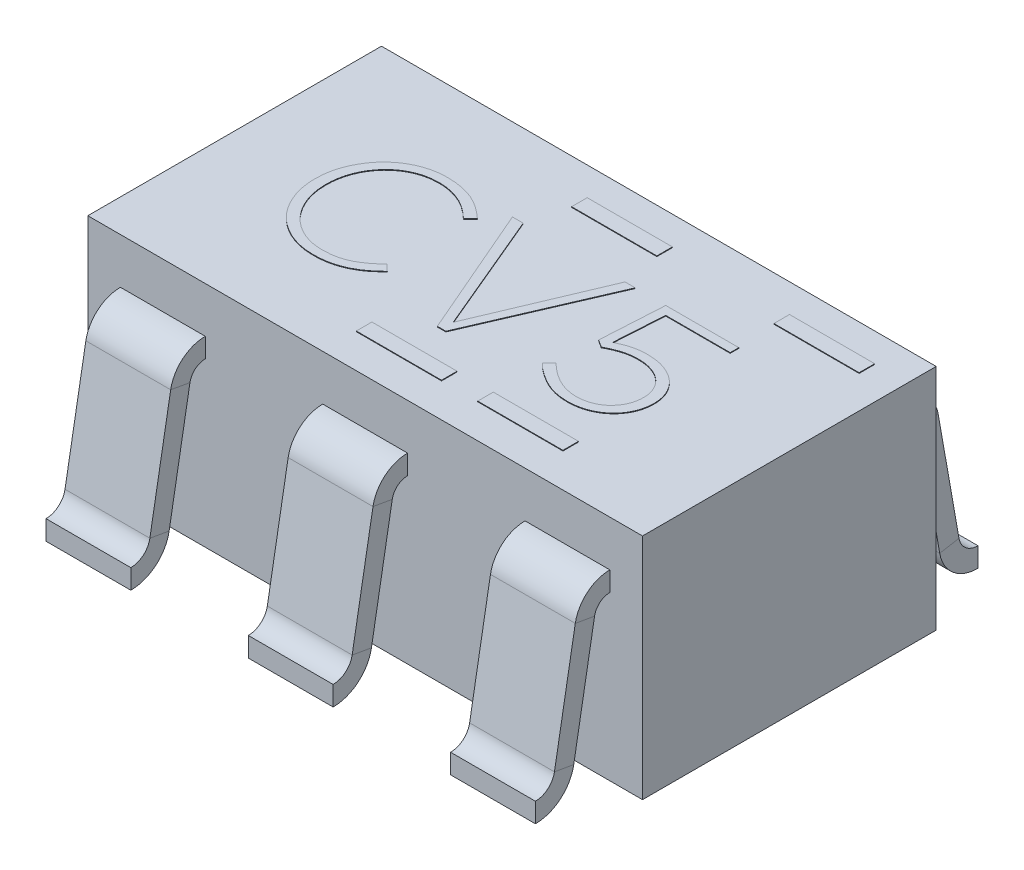
from build123d import *

# Parameters (mm, degrees)
SKETCH1_W           = 2.159
SKETCH1_H           = 1.143
BOSS_EXTRUDE1_DEPTH = 0.889
SKETCH2_W           = 0.3302
SKETCH2_H           = 0.0762
SKETCH4_W           = 0.3302
SKETCH4_H           = 0.0762
SKETCH5_W           = 0.331663062
SKETCH5_H           = 0.06055278
BOSS_EXTRUDE2_DEPTH = 0.00254


with BuildPart() as part:
    # Sketch1 → Boss-Extrude1 (new body)
    with BuildSketch(Plane(origin=(0, 0, 0), x_dir=(1, 0, 0), z_dir=(0, 1, 0))):
        Rectangle(SKETCH1_W, SKETCH1_H)
    extrude(amount=BOSS_EXTRUDE1_DEPTH)

    # Sweep1: sweep along a path in Sketch3
    with BuildLine(Plane(origin=(0, 0, 0), x_dir=(0, 0, -1), z_dir=(1, 0, 0))) as sweep1_path:
        ThreePointArc((-0.861267633, 0), (-0.763979988, 0.035409807), (-0.712214314, 0.125070585))
        Line((-0.712214314, 0.125070585), (-0.631121327, 0.584971766))
        ThreePointArc((-0.631121327, 0.584971766), (-0.610415058, 0.620836077), (-0.5715, 0.635))
    # Sketch2 → Sweep1 (sweep)
    with BuildSketch(Plane.XY.offset(0.5715)):
        with Locations((-0.7874, 0.6731)):
            Rectangle(SKETCH2_W, SKETCH2_H)
        with Locations((0.7874, 0.6731)):
            Rectangle(SKETCH2_W, SKETCH2_H)
    sweep1 = sweep(path=sweep1_path.line)

    # Mirror1: Sweep1 across plane
    add(sweep1.mirror(Plane.XY))

    # Sweep2: sweep along a path in Sketch3<2>
    with BuildLine(Plane(origin=(0, 0, 0), x_dir=(0, 0, -1), z_dir=(1, 0, 0))) as sweep2_path:
        ThreePointArc((-0.861267633, 0), (-0.763979988, 0.035409807), (-0.712214314, 0.125070585))
        Line((-0.712214314, 0.125070585), (-0.631121327, 0.584971766))
        ThreePointArc((-0.631121327, 0.584971766), (-0.610415058, 0.620836077), (-0.5715, 0.635))
    # Sketch4 → Sweep2 (sweep)
    with BuildSketch(Plane.XY.offset(0.5715)):
        with Locations((0, 0.6731)):
            Rectangle(SKETCH4_W, SKETCH4_H)
    sweep(path=sweep2_path.line)

    # Sketch5 → Boss-Extrude2 (add)
    with BuildSketch(Plane(origin=(0, 0.889, 0), x_dir=(1, 0, 0), z_dir=(0, 1, 0))):
        with Locations((0, 0.428222097)):
            Rectangle(SKETCH5_W, SKETCH5_H)
        with Locations((0, -0.409764759)):
            Rectangle(SKETCH5_W, SKETCH5_H)
        with Locations((0.472520764, -0.409764759)):
            Rectangle(SKETCH5_W, SKETCH5_H)
        with Locations((0.7874, 0.428222097)):
            Rectangle(SKETCH5_W, SKETCH5_H)
        with BuildLine():
            add(Edge.make_bspline(
                [(-0.507148397, -0.266530468), (-0.516004062, -0.266294122), (-0.533483711, -0.265827613), (-0.559226467, -0.261984327), (-0.583951487, -0.25558492), (-0.607575838, -0.246825997), (-0.629831551, -0.235789415), (-0.650715741, -0.222985246), (-0.669897071, -0.208097721), (-0.687638562, -0.191631506), (-0.70351359, -0.173255806), (-0.717682508, -0.153325217), (-0.730032672, -0.131802707), (-0.740548666, -0.108883725), (-0.749060866, -0.084753269), (-0.755090531, -0.059664466), (-0.758731432, -0.033734206), (-0.759226432, -0.016197616), (-0.759477344, -0.007308428)],
                knots=[0, 0, 0, 0, 1.054195513, 2.080811273, 3.09136329, 4.090928071, 5.075437235, 6.045312843, 7.0030623, 7.962201522, 8.923166792, 9.889447214, 10.870064349, 11.873653196, 12.888490594, 13.912113605, 14.941663336, 16, 16, 16, 16], degree=3))
            Line((-0.759477344, -0.007308428), (-0.759477344, -0.005846257))
            add(Edge.make_bspline(
                [(-0.759477344, -0.005846257), (-0.759233862, 0.002939366), (-0.758752483, 0.020309046), (-0.75498612, 0.045997417), (-0.748805696, 0.070927441), (-0.740273046, 0.095037208), (-0.729424891, 0.117928225), (-0.717111271, 0.139648693), (-0.702714075, 0.159670138), (-0.686895619, 0.178373653), (-0.669203848, 0.195244904), (-0.650021202, 0.210455446), (-0.62910642, 0.223465742), (-0.606852552, 0.23470478), (-0.583216962, 0.243725639), (-0.558358696, 0.250182657), (-0.532378411, 0.254174408), (-0.514682579, 0.254614311), (-0.505686226, 0.254837953)],
                knots=[0, 0, 0, 0, 1.041832373, 2.059762397, 3.072350947, 4.084602614, 5.087749651, 6.073758899, 7.042027807, 8.008630923, 8.975383991, 9.937007889, 10.907467045, 11.891814537, 12.890386669, 13.902031662, 14.933417564, 16, 16, 16, 16], degree=3))
            add(Edge.make_bspline(
                [(-0.505686226, 0.254837953), (-0.500148127, 0.254802759), (-0.48937231, 0.254734278), (-0.473627058, 0.253481406), (-0.45869352, 0.251795116), (-0.44451559, 0.249237701), (-0.430985983, 0.246114503), (-0.417988527, 0.242327636), (-0.405480578, 0.237997005), (-0.38958505, 0.231239197), (-0.370577221, 0.221539205), (-0.349199721, 0.207512116), (-0.328706848, 0.19189923), (-0.315841334, 0.180357552), (-0.309337542, 0.174522986)],
                knots=[0, 0, 0, 0, 0.914254497, 1.778920911, 2.606817561, 3.395102384, 4.156514643, 4.898826745, 5.629742143, 6.340854795, 7.749865447, 9.146767208, 10.55762974, 12, 12, 12, 12], degree=3))
            Line((-0.309337542, 0.174522986), (-0.336074384, 0.1471595))
            add(Edge.make_bspline(
                [(-0.336074384, 0.1471595), (-0.341648926, 0.152352202), (-0.352771327, 0.162712751), (-0.370557647, 0.176855412), (-0.389109711, 0.189876206), (-0.40931986, 0.200539535), (-0.430986673, 0.209385531), (-0.450249932, 0.214997837), (-0.466520306, 0.218351942), (-0.479401357, 0.220055233), (-0.492746026, 0.221301889), (-0.501818861, 0.221378216), (-0.506417312, 0.221416901)],
                knots=[0, 0, 0, 0, 1.196272513, 2.386819074, 3.566920493, 4.751031721, 5.967618357, 7.237862974, 7.896368677, 8.575399611, 9.277959423, 10, 10, 10, 10], degree=3))
            add(Edge.make_bspline(
                [(-0.506417312, 0.221416901), (-0.513879875, 0.221231437), (-0.528598993, 0.22086563), (-0.550266689, 0.217499069), (-0.571122473, 0.212127237), (-0.59099454, 0.204421397), (-0.609799831, 0.194915239), (-0.62743277, 0.183727735), (-0.64370962, 0.170774705), (-0.65865625, 0.156260563), (-0.672114795, 0.140215442), (-0.684218216, 0.122924296), (-0.694683588, 0.104230211), (-0.703501728, 0.084331902), (-0.710712304, 0.063402073), (-0.71562768, 0.041507132), (-0.718777182, 0.018823511), (-0.719171911, 0.003424741), (-0.719372081, -0.004384086)],
                knots=[0, 0, 0, 0, 1.034860358, 2.041152744, 3.034703784, 4.017914397, 4.992208653, 5.954356592, 6.910190429, 7.873513869, 8.840222493, 9.811746631, 10.797978486, 11.807847073, 12.828266177, 13.864129433, 14.916884699, 16, 16, 16, 16], degree=3))
            Line((-0.719372081, -0.004384086), (-0.719372081, -0.005846257))
            add(Edge.make_bspline(
                [(-0.719372081, -0.005846257), (-0.719180299, -0.013656152), (-0.718801148, -0.029096243), (-0.715512394, -0.05184426), (-0.7105084, -0.073892468), (-0.703101485, -0.094959649), (-0.694050513, -0.11496879), (-0.683445081, -0.133763561), (-0.671454414, -0.151260362), (-0.657920013, -0.167324934), (-0.642950053, -0.181839036), (-0.626708783, -0.194899587), (-0.609071935, -0.206186623), (-0.590268594, -0.215801752), (-0.570395391, -0.223600027), (-0.549551587, -0.229121435), (-0.52786311, -0.232419424), (-0.513147734, -0.232877265), (-0.505686226, -0.233109415)],
                knots=[0, 0, 0, 0, 1.079242995, 2.133653515, 3.171588202, 4.200589649, 5.215182267, 6.204443786, 7.180407667, 8.143660157, 9.103539566, 10.058955548, 11.020257913, 11.99325002, 12.97468206, 13.965908815, 14.968603549, 16, 16, 16, 16], degree=3))
            add(Edge.make_bspline(
                [(-0.505686226, -0.233109415), (-0.501193655, -0.233050529), (-0.492337728, -0.232934451), (-0.479299095, -0.231979648), (-0.466680499, -0.230407487), (-0.454539161, -0.228249807), (-0.442807999, -0.225423122), (-0.431602868, -0.221852655), (-0.420770462, -0.21779277), (-0.406847719, -0.211444443), (-0.389949814, -0.201744453), (-0.370035182, -0.188260028), (-0.350450367, -0.172411054), (-0.3380448, -0.160545641), (-0.331687871, -0.1544655)],
                knots=[0, 0, 0, 0, 0.822135291, 1.620624348, 2.391144691, 3.148513217, 3.876362449, 4.597769171, 5.299493563, 5.99236891, 7.395933389, 8.859155827, 10.390551289, 12, 12, 12, 12], degree=3))
            Line((-0.331687871, -0.1544655), (-0.306517641, -0.179009086))
            add(Edge.make_bspline(
                [(-0.306517641, -0.179009086), (-0.313282789, -0.185270427), (-0.326676453, -0.197666649), (-0.347602199, -0.21496314), (-0.369789737, -0.230078111), (-0.389445295, -0.240603131), (-0.405842335, -0.247916696), (-0.418734117, -0.252530715), (-0.4320494, -0.256783897), (-0.445926101, -0.260314289), (-0.460353862, -0.263155529), (-0.475387195, -0.265134736), (-0.491046721, -0.266271942), (-0.501715623, -0.26644324), (-0.507148397, -0.266530468)],
                knots=[0, 0, 0, 0, 1.473488271, 2.917216759, 4.335764993, 5.757540972, 6.475182698, 7.204086771, 7.945106539, 8.709093146, 9.491664519, 10.294494744, 11.131529659, 12, 12, 12, 12], degree=3))
        make_face()
        Polygon((-0.246464187, 0.248153743), (-0.20458343, 0.248153743), (-0.006772575, -0.222038691), (0.191769366, 0.248153743), (0.231456866, 0.248153743), (0.009102425, -0.266530468), (-0.024109746, -0.266530468), align=None)
        with BuildLine():
            add(Edge.make_bspline(
                [(0.480234827, -0.266530468), (0.47168649, -0.266255318), (0.454753779, -0.265710295), (0.429737761, -0.261154006), (0.40552872, -0.253718045), (0.38230305, -0.243405597), (0.36035076, -0.230974224), (0.339739056, -0.217200515), (0.320665209, -0.202136982), (0.309143011, -0.191012963), (0.30341657, -0.185484415)],
                knots=[0, 0, 0, 0, 1.027091986, 2.034483686, 3.045944865, 4.065436139, 5.082966719, 6.075467794, 7.043522885, 8, 8, 8, 8], degree=3))
            Line((0.30341657, -0.185484415), (0.330153412, -0.158747573))
            add(Edge.make_bspline(
                [(0.330153412, -0.158747573), (0.335914703, -0.164311572), (0.347236392, -0.175245557), (0.365416009, -0.189683487), (0.383813761, -0.202577462), (0.402684641, -0.213447845), (0.421925221, -0.222276477), (0.44161431, -0.228420326), (0.46155471, -0.232390043), (0.474994583, -0.232870041), (0.481696998, -0.233109415)],
                knots=[0, 0, 0, 0, 1.109179193, 2.17968211, 3.212685538, 4.219648281, 5.193340946, 6.139214123, 7.072032972, 8, 8, 8, 8], degree=3))
            add(Edge.make_bspline(
                [(0.481696998, -0.233109415), (0.486645725, -0.232983964), (0.496366705, -0.232737534), (0.510602808, -0.230951237), (0.524153616, -0.227951292), (0.53692357, -0.223614516), (0.548925915, -0.218321864), (0.560065946, -0.212042657), (0.570265792, -0.204772817), (0.579586176, -0.196629938), (0.587941612, -0.187574231), (0.595487102, -0.177901375), (0.602020727, -0.167434153), (0.60756542, -0.156294698), (0.611909994, -0.144479638), (0.615210595, -0.13222824), (0.617111695, -0.119502719), (0.61734968, -0.110885003), (0.617470024, -0.106527178)],
                knots=[0, 0, 0, 0, 1.145346535, 2.249849336, 3.315357495, 4.352544201, 5.366331399, 6.347897687, 7.307179358, 8.260859585, 9.207397063, 10.155202969, 11.096546173, 12.058801949, 13.030293121, 14.005687019, 14.991511462, 16, 16, 16, 16], degree=3))
            Line((0.617470024, -0.106527178), (0.617470024, -0.105169448))
            add(Edge.make_bspline(
                [(0.617470024, -0.105169448), (0.617350897, -0.1009158), (0.617116322, -0.092539822), (0.615219895, -0.08022716), (0.611928494, -0.068488808), (0.607550186, -0.057275579), (0.602017365, -0.046670663), (0.595264118, -0.036867277), (0.58765048, -0.027689531), (0.578883835, -0.019444068), (0.569260829, -0.011889483), (0.558674796, -0.005175804), (0.547098103, 0.000558154), (0.534720973, 0.005415121), (0.521649079, 0.009440776), (0.507903501, 0.012224606), (0.493577624, 0.013940297), (0.483825529, 0.014116809), (0.478877096, 0.014206375)],
                knots=[0, 0, 0, 0, 0.997445971, 1.964098809, 2.913068328, 3.851722655, 4.783138491, 5.711758029, 6.63915603, 7.574857543, 8.528837996, 9.505237224, 10.509512245, 11.554302971, 12.621166842, 13.713386878, 14.839721157, 16, 16, 16, 16], degree=3))
            add(Edge.make_bspline(
                [(0.478877096, 0.014206375), (0.4731297, 0.014070605), (0.461958129, 0.013806702), (0.445657375, 0.012207338), (0.430403541, 0.009149277), (0.411614304, 0.003688869), (0.3896189, -0.004905242), (0.373014405, -0.013370118), (0.364827754, -0.017543625)],
                knots=[0, 0, 0, 0, 0.864106721, 1.679617632, 2.458643664, 3.199094088, 4.619046371, 6, 6, 6, 6], degree=3))
            Line((0.364827754, -0.017543625), (0.335897656, 0.001151276))
            Line((0.335897656, 0.001151276), (0.350310484, 0.248153743))
            Line((0.350310484, 0.248153743), (0.634598313, 0.248153743))
            Line((0.634598313, 0.248153743), (0.634598313, 0.21473269))
            Line((0.634598313, 0.21473269), (0.383522656, 0.21473269))
            Line((0.383522656, 0.21473269), (0.371303083, 0.020577263))
            add(Edge.make_bspline(
                [(0.371303083, 0.020577263), (0.379521799, 0.024396363), (0.395903169, 0.032008513), (0.417517928, 0.03913182), (0.435607931, 0.043776546), (0.450453441, 0.045894769), (0.466414294, 0.047479554), (0.477445122, 0.047576967), (0.483159169, 0.047627427)],
                knots=[0, 0, 0, 0, 1.402637683, 2.795707893, 3.517593015, 4.292393027, 5.115447508, 6, 6, 6, 6], degree=3))
            add(Edge.make_bspline(
                [(0.483159169, 0.047627427), (0.489188405, 0.047484502), (0.501074569, 0.047202736), (0.518537824, 0.045048848), (0.535342263, 0.041678968), (0.551325543, 0.036665641), (0.566569985, 0.030704411), (0.580829875, 0.023428389), (0.59415966, 0.015168639), (0.606505358, 0.005846122), (0.617892712, -0.004434821), (0.627773259, -0.016065738), (0.636672319, -0.028492433), (0.644017336, -0.042034178), (0.650195155, -0.056307487), (0.654411556, -0.071488876), (0.657148871, -0.087349929), (0.65743159, -0.09819505), (0.657575287, -0.103707277)],
                knots=[0, 0, 0, 0, 1.123273924, 2.214445758, 3.274310636, 4.312692179, 5.33188634, 6.321261941, 7.291587211, 8.25045863, 9.200953541, 10.143890608, 11.088878704, 12.044166038, 13.009337543, 13.980681618, 14.973645425, 16, 16, 16, 16], degree=3))
            Line((0.657575287, -0.103707277), (0.657575287, -0.105169448))
            add(Edge.make_bspline(
                [(0.657575287, -0.105169448), (0.657432162, -0.111029074), (0.65715123, -0.122530614), (0.654425302, -0.139330209), (0.650195104, -0.155370813), (0.644048143, -0.170459834), (0.636676203, -0.184747521), (0.627794518, -0.197921171), (0.61784931, -0.210274326), (0.606567125, -0.221496932), (0.594185771, -0.231668254), (0.580762192, -0.240736617), (0.566149349, -0.248413409), (0.550643792, -0.25504358), (0.534140782, -0.260114583), (0.516897456, -0.263910331), (0.498813372, -0.266123712), (0.486507285, -0.266393139), (0.480234827, -0.266530468)],
                knots=[0, 0, 0, 0, 1.04914212, 2.05930394, 3.041340515, 4.015500302, 4.972493289, 5.917106832, 6.857219733, 7.80995437, 8.762791105, 9.724711486, 10.706985765, 11.716087755, 12.742015645, 13.795469643, 14.876342745, 16, 16, 16, 16], degree=3))
        make_face()
    extrude(amount=BOSS_EXTRUDE2_DEPTH)


solid = part.part
